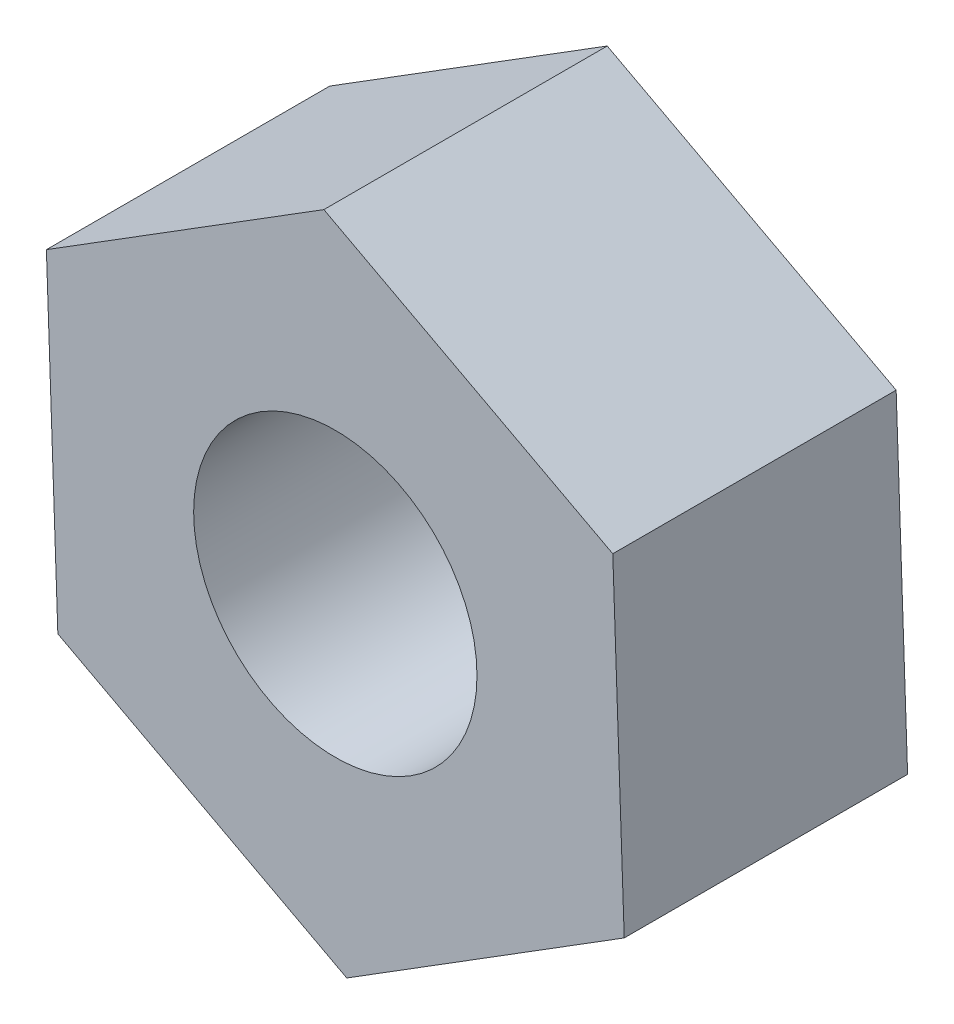
from build123d import *

# Parameters (mm, degrees)
SKETCH_1_R      = 2
EXTRUDE_1_DEPTH = 4


with BuildPart() as part:
    # ｽｹｯﾁ1 → ﾎﾞｽ - 押し出し1 (new body)
    with BuildSketch(Plane.XY):
        Polygon((3.916727434, 2.447974579), (-0.161644456, 4.615972747), (-4.07837189, 2.167998169), (-3.916727434, -2.447974579), (0.161644456, -4.615972747), (4.07837189, -2.167998169), align=None)
        Circle(SKETCH_1_R, mode=Mode.SUBTRACT)
    extrude(amount=EXTRUDE_1_DEPTH)


solid = part.part
